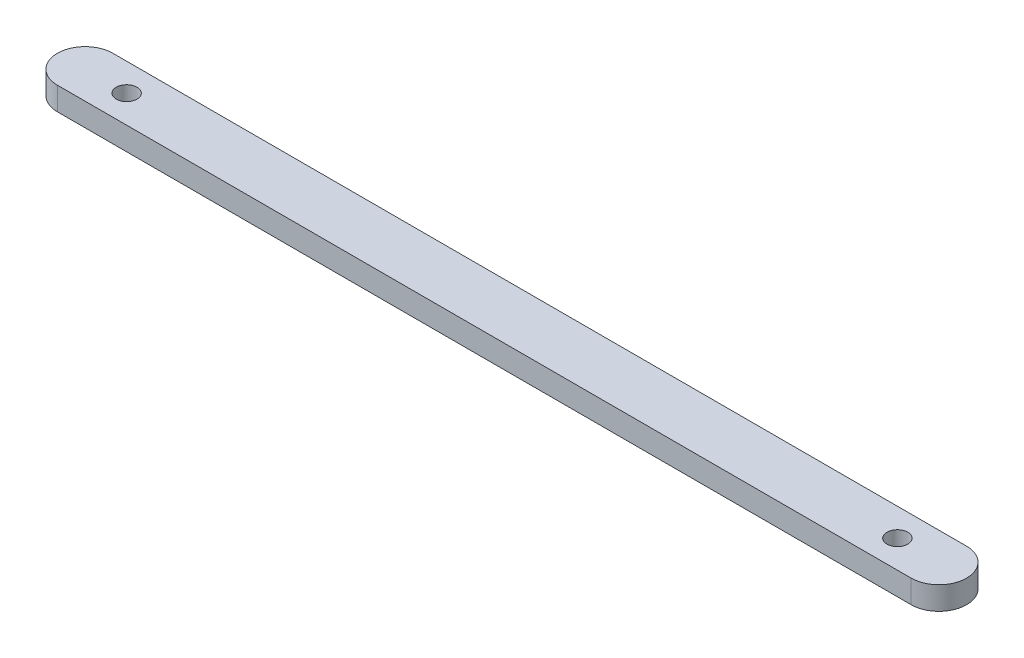
from build123d import *

# Parameters (mm, degrees)
BOSS_EXTRUDE1_DEPTH = 5
SKETCH2_R           = 2.25
CUT_EXTRUDE1_DEPTH  = 8


with BuildPart() as part:
    # Sketch1 → Boss-Extrude1 (new body)
    with BuildSketch(Plane(origin=(0, 0, 0), x_dir=(1, 0, 0), z_dir=(0, 1, 0))):
        with BuildLine():
            Line((-40.340178872, 6), (144.659821128, 6))
            ThreePointArc((144.659821128, 6), (150.659821128, 0), (144.659821128, -6))
            Line((144.659821128, -6), (-40.340178872, -6))
            ThreePointArc((-40.340178872, -6), (-46.340178872, 0), (-40.340178872, 6))
        make_face()
    extrude(amount=BOSS_EXTRUDE1_DEPTH)

    # Sketch2 → Cut-Extrude1 (cut)
    with BuildSketch(Plane(origin=(0, 5, 0), x_dir=(1, 0, 0), z_dir=(0, 1, 0))):
        with Locations(Location((-31.340178872, 0, 0), (0, 0, 270))):
            Circle(SKETCH2_R)
        with Locations(Location((135.659821128, 0, 0), (0, 0, 270))):
            Circle(SKETCH2_R)
    extrude(amount=-CUT_EXTRUDE1_DEPTH, mode=Mode.SUBTRACT)


solid = part.part
